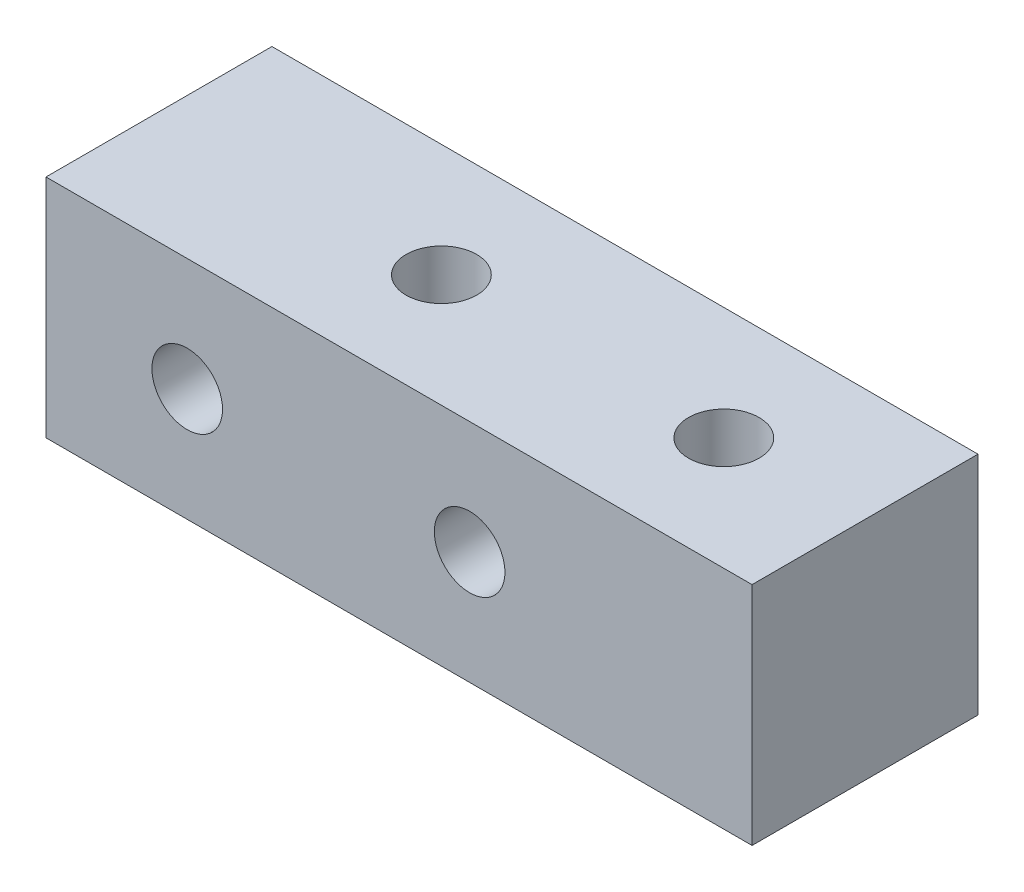
from build123d import *

# Parameters (mm, degrees)
SKETCH_1_W         = 25
SKETCH_1_H         = 8
EXTRUDE_1_DEPTH    = 8
HOLE_WIZARD_M3_1_D = 2.5
HOLE_WIZARD_M3_2_D = 2.5


with BuildPart() as part:
    # 草图1 → 凸台-拉伸1 (new body)
    with BuildSketch(Plane(origin=(0, 0, 0), x_dir=(1, 0, 0), z_dir=(0, 1, 0))):
        Rectangle(SKETCH_1_W, SKETCH_1_H)
    extrude(amount=EXTRUDE_1_DEPTH)

    # M3 螺纹孔1 (through all)
    with Locations(Plane.XY.offset(4)):
        with Locations((2.5, 4), (-7.5, 4)):
            Hole(HOLE_WIZARD_M3_1_D / 2)

    # M3 螺纹孔2 (through all)
    with Locations(Plane(origin=(0, 8, 0), x_dir=(1, 0, 0), z_dir=(0, 1, 0))):
        with Locations((7.5, 0), (-2.5, 0)):
            Hole(HOLE_WIZARD_M3_2_D / 2)


solid = part.part
